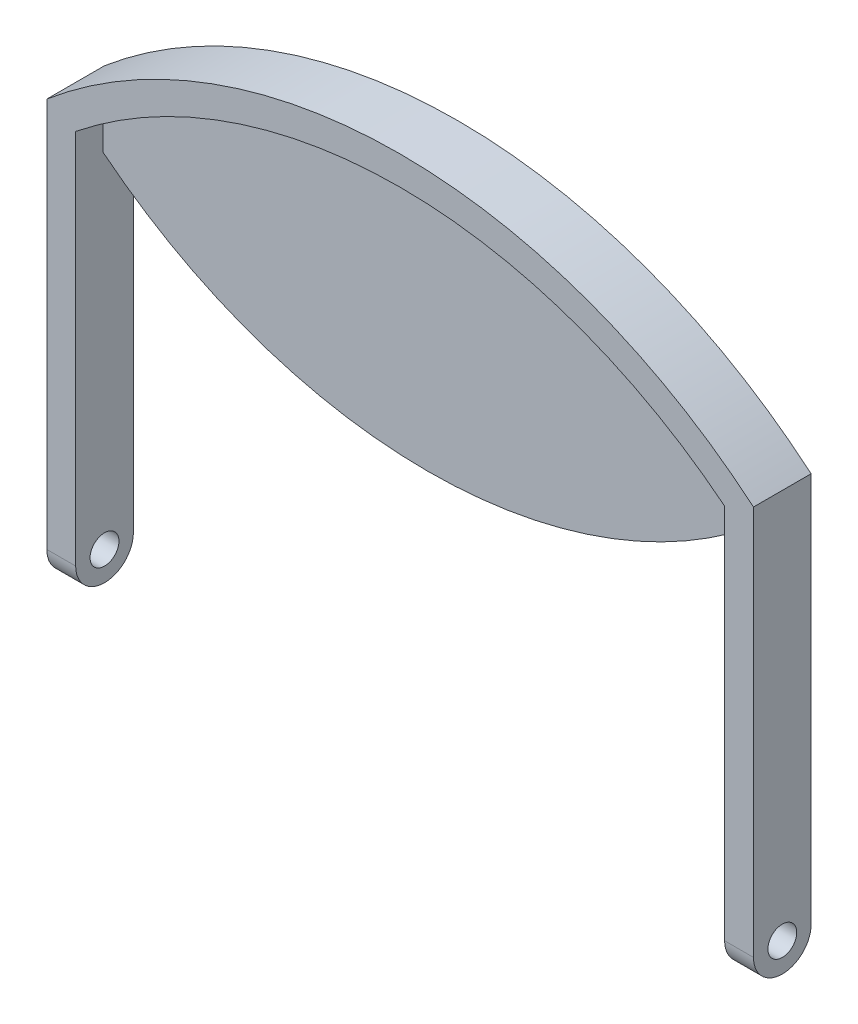
from build123d import *

# Parameters (mm, degrees)
EXTRUDE_1_DEPTH          = 40
CUT_EXTRUDE_1_DEPTH      = 19
CUT_EXTRUDE_START        = -19
CUT_EXTRUDE_2_DEPTH      = 19
CUT_EXTRUDE_3_DEPTH      = 622.369455316
CUT_EXTRUDE_4_DEPTH      = 622.369455316
CUT_EXTRUDE_4_DEPTH_BACK = 622.369455316
SKETCH_5_R               = 10.007014795


with BuildPart() as part:
    # 草图1 → 凸台-拉伸1 (new body)
    with BuildSketch(Plane.XY):
        with BuildLine():
            Line((245, 0), (245, 290.473750966))
            ThreePointArc((245, 290.473750966), (0, 380), (-245, 290.473750966))
            Line((-245, 290.473750966), (-245, 0))
            Line((-245, 0), (-225, 0))
            Line((-225, 0), (-225, 258.975090072))
            ThreePointArc((-225, 258.975090072), (0, 180), (225, 258.975090072))
            Line((225, 258.975090072), (225, 0))
            Line((225, 0), (245, 0))
        make_face()
    extrude(amount=EXTRUDE_1_DEPTH)

    # 草图2 → 切除-拉伸1 (cut)
    with BuildSketch(Plane(origin=(0, 0, 0), x_dir=(-1, 0, 0), z_dir=(0, 0, -1))):
        with BuildLine():
            Line((225, 258.975090072), (225, 281.024909928))
            ThreePointArc((225, 281.024909928), (0, 360), (-225, 281.024909928))
            Line((-225, 281.024909928), (-225, 258.975090072))
            ThreePointArc((-225, 258.975090072), (0, 180), (225, 258.975090072))
        make_face()
    extrude(amount=-CUT_EXTRUDE_1_DEPTH, mode=Mode.SUBTRACT)

    # 草图3 → 切除-拉伸2 (cut)
    with BuildSketch(Plane.XY.offset(40).offset(CUT_EXTRUDE_START)):
        with BuildLine():
            Line((225, 258.975090072), (225, 281.024909928))
            ThreePointArc((225, 281.024909928), (0, 360), (-225, 281.024909928))
            Line((-225, 281.024909928), (-225, 258.975090072))
            ThreePointArc((-225, 258.975090072), (0, 180), (225, 258.975090072))
        make_face()
    extrude(amount=CUT_EXTRUDE_2_DEPTH, mode=Mode.SUBTRACT)

    # 草图4 → 切除-拉伸3 (cut, through all)
    with BuildSketch(Plane(origin=(245, 0, 0), x_dir=(0, 0, -1), z_dir=(1, 0, 0))):
        with BuildLine():
            ThreePointArc((-20, 0), (-34.142135624, 5.857864376), (-40, 20))
            Line((-40, 20), (-40, 0))
            Line((-40, 0), (-20, 0))
        make_face()
        with BuildLine():
            ThreePointArc((0, 20), (-5.857864376, 5.857864376), (-20, 0))
            Line((-20, 0), (0, 0))
            Line((0, 0), (0, 20))
        make_face()
    extrude(amount=-CUT_EXTRUDE_3_DEPTH, mode=Mode.SUBTRACT)

    # 草图5 → 切除-拉伸4 (cut, two sides: drawn at the far end of the back side and taken through both)
    with BuildSketch(Plane.ZY.offset(245).offset(-CUT_EXTRUDE_4_DEPTH_BACK)):
        with Locations(Location((20, 20, 0), (0, 0, 270))):
            Circle(SKETCH_5_R)
    extrude(amount=CUT_EXTRUDE_4_DEPTH + CUT_EXTRUDE_4_DEPTH_BACK, mode=Mode.SUBTRACT)


solid = part.part
